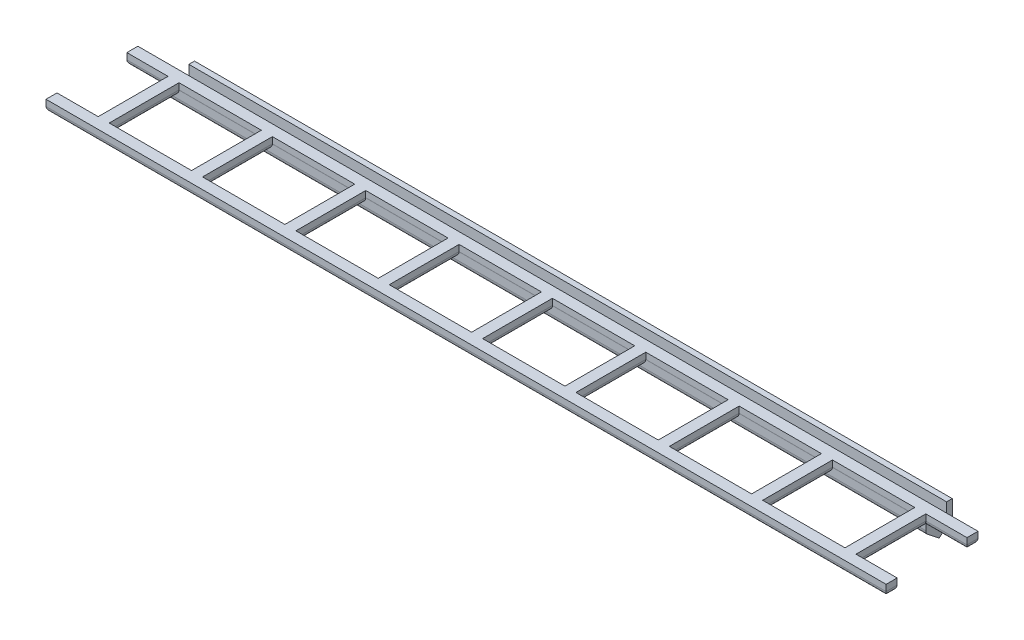
from build123d import *

# Parameters (mm, degrees)
SKETCH1_W           = 22.4
SKETCH1_H           = 19
BOSS_EXTRUDE1_DEPTH = 3
FILLET2_R           = 1.3
BOSS_EXTRUDE2_REACH = 220.391


with BuildPart() as part:
    # Sketch1 → Boss-Extrude1 (new body)
    with BuildSketch(Plane(origin=(0, 0, 0), x_dir=(1, 0, 0), z_dir=(0, 1, 0))):
        Polygon((-1.892946275, -20.564259839), (226.707053725, -20.564259839), (226.707053725, -17.564259839), (215.507053725, -17.564259839), (215.507053725, 1.435740161), (226.707053725, 1.435740161), (226.707053725, 4.435740161), (-1.892946275, 4.435740161), (-1.892946275, 1.435740161), (9.307053725, 1.435740161), (9.307053725, -17.564259839), (-1.892946275, -17.564259839), align=None)
        with Locations((23.507053725, -8.064259839)):
            Rectangle(SKETCH1_W, SKETCH1_H, mode=Mode.SUBTRACT)
        with Locations((201.307053725, -8.064259839)):
            Rectangle(SKETCH1_W, SKETCH1_H, mode=Mode.SUBTRACT)
        with Locations((175.907053725, -8.064259839)):
            Rectangle(SKETCH1_W, SKETCH1_H, mode=Mode.SUBTRACT)
        with Locations((150.507053725, -8.064259839)):
            Rectangle(SKETCH1_W, SKETCH1_H, mode=Mode.SUBTRACT)
        with Locations((125.107053725, -8.064259839)):
            Rectangle(SKETCH1_W, SKETCH1_H, mode=Mode.SUBTRACT)
        with Locations((99.707053725, -8.064259839)):
            Rectangle(SKETCH1_W, SKETCH1_H, mode=Mode.SUBTRACT)
        with Locations((74.307053725, -8.064259839)):
            Rectangle(SKETCH1_W, SKETCH1_H, mode=Mode.SUBTRACT)
        with Locations((48.907053725, -8.064259839)):
            Rectangle(SKETCH1_W, SKETCH1_H, mode=Mode.SUBTRACT)
    extrude(amount=BOSS_EXTRUDE1_DEPTH)

    # Fillet2
    fillet2_edges = [part.edges().sort_by_distance(p)[0] for p in [
        (113.907053725, 0, 8.064259839),
        (125.107053725, 0, 17.564259839),
        (110.907053725, 0, 8.064259839),
        (125.107053725, 0, -1.435740161),
        (139.307053725, 0, 8.064259839),
        (150.507053725, 0, 17.564259839),
        (3.707053725, 0, -1.435740161),
        (136.307053725, 0, 8.064259839),
        (150.507053725, 0, -1.435740161),
        (9.307053725, 0, 8.064259839),
        (161.707053725, 0, 8.064259839),
        (3.707053725, 0, 17.564259839),
        (175.907053725, 0, -1.435740161),
        (164.707053725, 0, 8.064259839),
        (175.907053725, 0, 17.564259839),
        (-1.892946275, 0, 19.064259839),
        (187.107053725, 0, 8.064259839),
        (112.407053725, 0, 20.564259839),
        (201.307053725, 0, -1.435740161),
        (190.107053725, 0, 8.064259839),
        (201.307053725, 0, 17.564259839),
        (212.507053725, 0, 8.064259839),
        (226.707053725, 0, -2.935740161),
        (221.107053725, 0, -1.435740161),
        (215.507053725, 0, 8.064259839),
        (221.107053725, 0, 17.564259839),
        (23.507053725, 0, 17.564259839),
        (226.707053725, 0, 19.064259839),
        (12.307053725, 0, 8.064259839),
        (23.507053725, 0, -1.435740161),
        (112.407053725, 0, -4.435740161),
        (-1.892946275, 0, -2.935740161),
        (34.707053725, 0, 8.064259839),
        (48.907053725, 0, -1.435740161),
        (37.707053725, 0, 8.064259839),
        (48.907053725, 0, 17.564259839),
        (60.107053725, 0, 8.064259839),
        (74.307053725, 0, -1.435740161),
        (63.107053725, 0, 8.064259839),
        (74.307053725, 0, 17.564259839),
        (85.507053725, 0, 8.064259839),
        (99.707053725, 0, -1.435740161),
        (88.507053725, 0, 8.064259839),
        (99.707053725, 0, 17.564259839),
    ]]
    fillet(fillet2_edges, radius=FILLET2_R)

    # Boss-Extrude2: up to this face of the body (flat: up to its plane)
    boss_extrude2_end = Plane(part.part.faces().sort_by_distance((9.307053725, 2.15, 8.064259839))[0])
    # Sketch2 → Boss-Extrude2 (add, up to the picked face)
    with BuildSketch(Plane(origin=(215.507053725, 0, 0), x_dir=(0, 0, -1), z_dir=(1, 0, 0)), mode=Mode.PRIVATE) as boss_extrude2_sk1:
        with BuildLine():
            Line((2.935740161, 1.3), (1.43659757, 1.3))
            Line((1.43659757, 1.3), (1.43659757, -0.960067332))
            ThreePointArc((1.43659757, -0.960067332), (1.588401468, -1.617613734), (2.013087264, -2.142069327))
            Line((2.013087264, -2.142069327), (5.035485323, -4.503499992))
            Line((5.035485323, -4.503499992), (8.250046613, -1.991930219))
            ThreePointArc((8.250046613, -1.991930219), (8.533170477, -1.642293157), (8.634373075, -1.203928889))
            Line((8.634373075, -1.203928889), (8.634373075, 3))
            Line((8.634373075, 3), (7.098760361, 3))
            Line((7.098760361, 3), (7.098760361, -0.691652004))
            Line((7.098760361, -0.691652004), (6.098760361, -1.691652004))
            Line((6.098760361, -1.691652004), (3.935740161, -1.691652004))
            Line((3.935740161, -1.691652004), (2.935740161, -0.691652004))
            Line((2.935740161, -0.691652004), (2.935740161, 1.3))
        make_face()
    boss_extrude2_tool1 = split(extrude(boss_extrude2_sk1.sketch, amount=-BOSS_EXTRUDE2_REACH, mode=Mode.PRIVATE), bisect_by=boss_extrude2_end, keep=Keep.BOTH, mode=Mode.PRIVATE)
    add(boss_extrude2_tool1.solids().sort_by(Axis((215.507054, 1.196024, -2.186169), (-1, 0, 0)))[0])


solid = part.part
